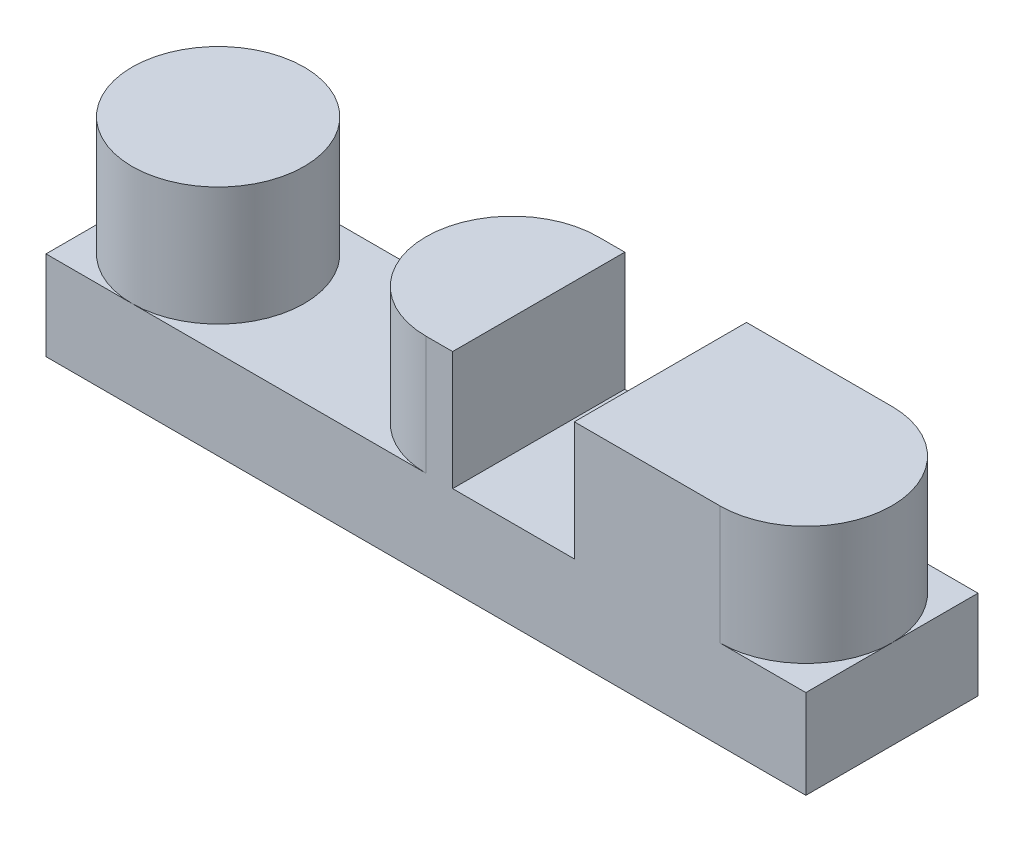
from build123d import *

# Parameters (mm, degrees)
SKETCH1_W           = 25.6
SKETCH1_H           = 5.8
BOSS_EXTRUDE1_DEPTH = 3
SKETCH1_4_R         = 2.9
BOSS_EXTRUDE2_DEPTH = 4


with BuildPart() as part:
    # Sketch1 → Boss-Extrude1 (new body)
    with BuildSketch(Plane(origin=(0, 0, 0), x_dir=(1, 0, 0), z_dir=(0, 1, 0))):
        with Locations((12.8, 2.9)):
            Rectangle(SKETCH1_W, SKETCH1_H)
    extrude(amount=-BOSS_EXTRUDE1_DEPTH)

    # Sketch1<4> → Boss-Extrude2 (add)
    with BuildSketch(Plane(origin=(0, 0, 0), x_dir=(1, 0, 0), z_dir=(0, 1, 0))):
        with BuildLine():
            Line((13.7, 0), (13.7, 5.8))
            Line((13.7, 5.8), (12.8, 5.8))
            ThreePointArc((12.8, 5.8), (9.9, 2.9), (12.8, 0))
            Line((12.8, 0), (13.7, 0))
        make_face()
        with Locations((2.9, 2.9)):
            Circle(SKETCH1_4_R)
        with BuildLine():
            Line((17.8, 5.8), (17.8, 0))
            Line((17.8, 0), (22.7, 0))
            ThreePointArc((22.7, 0), (25.6, 2.9), (22.7, 5.8))
            Line((22.7, 5.8), (17.8, 5.8))
        make_face()
    extrude(amount=BOSS_EXTRUDE2_DEPTH)


solid = part.part
